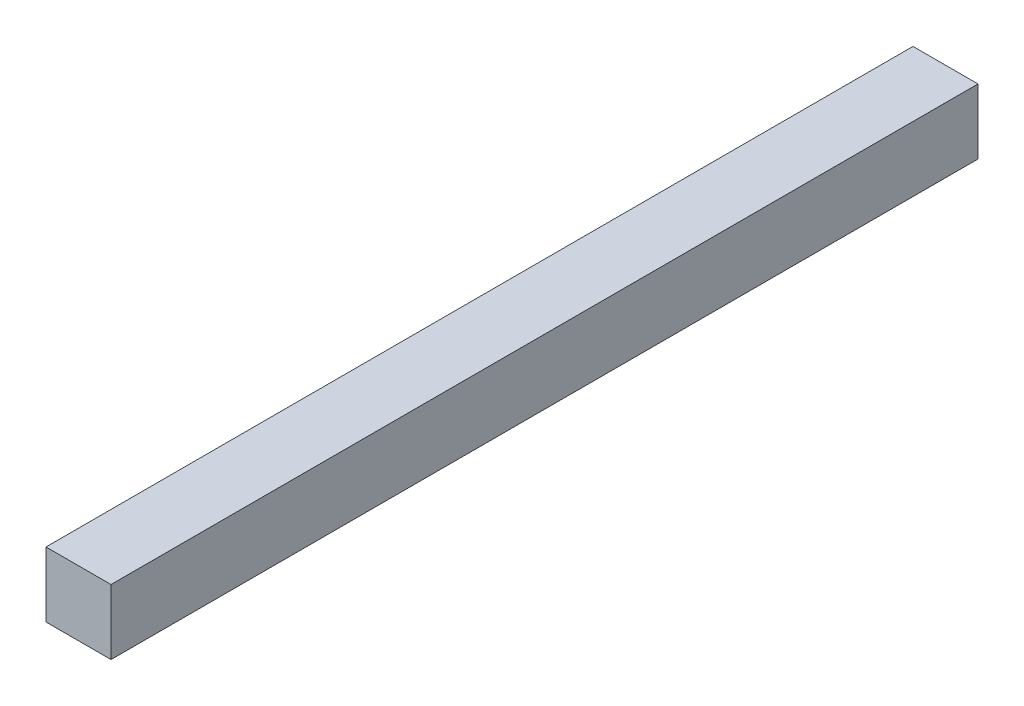
from build123d import *

# Parameters (mm, degrees)
SKETCH_1_W      = 30
SKETCH_1_H      = 30
EXTRUDE_1_DEPTH = 200


with BuildPart() as part:
    # 草图1 → 凸台-拉伸1 (new, symmetric)
    with BuildSketch(Plane.XY):
        Rectangle(SKETCH_1_W, SKETCH_1_H)
    extrude(amount=EXTRUDE_1_DEPTH, both=True)


solid = part.part
